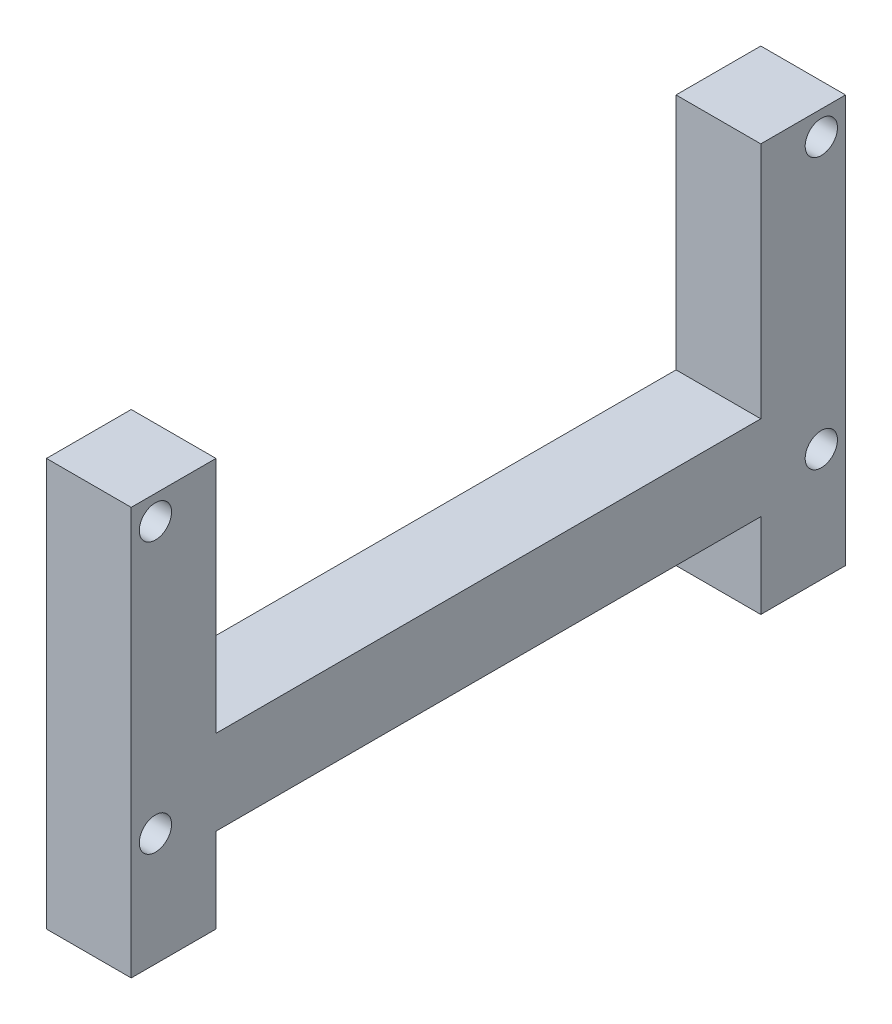
from build123d import *

# Parameters (mm, degrees)
SKETCH1_R           = 1.016
BOSS_EXTRUDE1_DEPTH = 5.334


with BuildPart() as part:
    # Sketch1 → Boss-Extrude1 (new body)
    with BuildSketch(Plane(origin=(0, 0, 0), x_dir=(0, 0, -1), z_dir=(1, 0, 0))):
        Polygon((0, 0), (5.334, 0), (5.334, 5.334), (39.624, 5.334), (39.624, 0), (44.958, 0), (44.958, 25.654), (39.624, 25.654), (39.624, 10.668), (5.334, 10.668), (5.334, 25.654), (0, 25.654), align=None)
        with Locations((1.524, 24.13)):
            Circle(SKETCH1_R, mode=Mode.SUBTRACT)
        with Locations((1.524, 7.112)):
            Circle(SKETCH1_R, mode=Mode.SUBTRACT)
        with Locations((43.434, 24.13)):
            Circle(SKETCH1_R, mode=Mode.SUBTRACT)
        with Locations((43.434, 7.112)):
            Circle(SKETCH1_R, mode=Mode.SUBTRACT)
    extrude(amount=BOSS_EXTRUDE1_DEPTH)


solid = part.part
